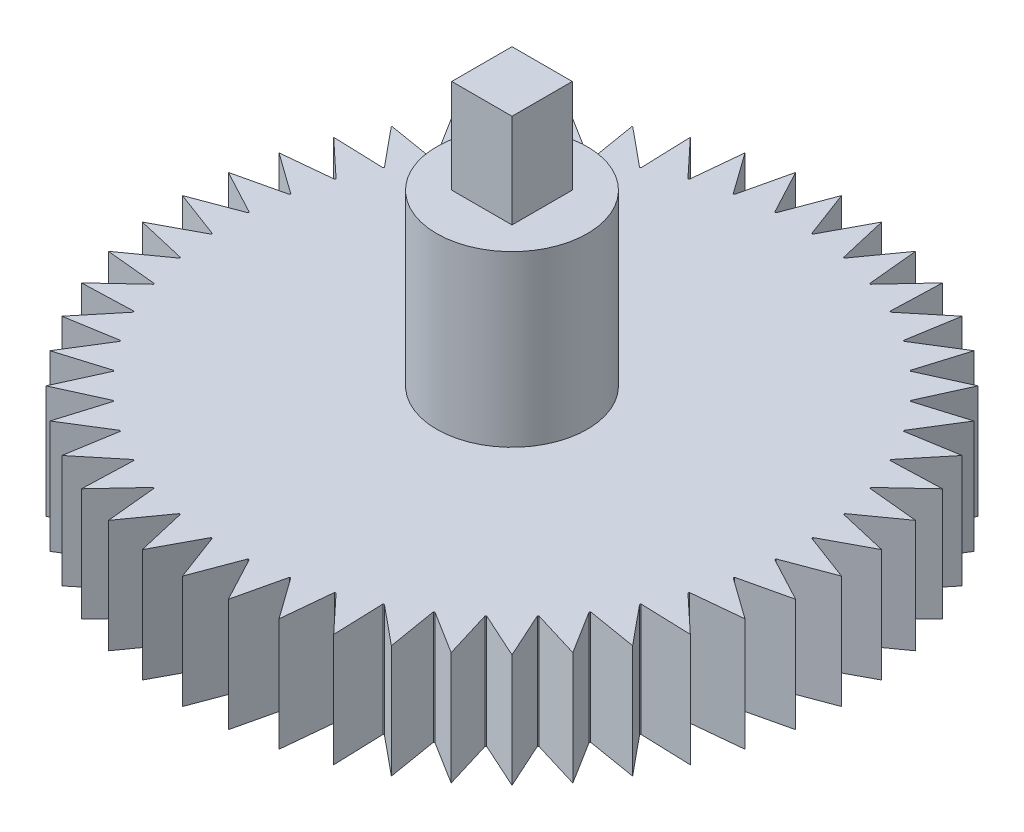
from build123d import *

# Parameters (mm, degrees)
EXTRUDE_5_DEPTH  = 6
EXTRUDE_6_DEPTH  = 6
SKETCH_6_R       = 4
EXTRUDE_9_DEPTH  = 5
EXTRUDE_START    = 9
SKETCH_4_R       = 4
EXTRUDE_10_DEPTH = 9
SKETCH_5_W       = 3.2
SKETCH_5_H       = 3.2
EXTRUDE_11_DEPTH = 5


with BuildPart() as part:
    # Эскиз1 → Бобышка-Вытянуть5 (new body)
    with BuildSketch(Plane(origin=(0, 0, 0), x_dir=(1, 0, 0), z_dir=(0, 1, 0))):
        with BuildLine():
            Line((2.895366476, 14.71790926), (2.284208364, 17.350285074))
            Line((2.284208364, 17.350285074), (1.012565965, 14.965784649))
            ThreePointArc((1.012565965, 14.965784649), (0.981046938, 14.967883849), (0.949523561, 14.969916667))
            Line((0.949523561, 14.969916667), (0, 17.5))
            Line((0, 17.5), (-0.949523561, 14.969916667))
            ThreePointArc((-0.949523561, 14.969916667), (-0.981046938, 14.967883849), (-1.012565965, 14.965784649))
            Line((-1.012565965, 14.965784649), (-2.284208364, 17.350285074))
            Line((-2.284208364, 17.350285074), (-2.895366476, 14.71790926))
            ThreePointArc((-2.895366476, 14.71790926), (-2.92635483, 14.711779206), (-2.957330207, 14.705583907))
            Line((-2.957330207, 14.705583907), (-4.529333289, 16.90370196))
            Line((-4.529333289, 16.90370196), (-4.791668867, 14.214074344))
            ThreePointArc((-4.791668867, 14.214074344), (-4.82159198, 14.203951942), (-4.851493708, 14.193766547))
            Line((-4.851493708, 14.193766547), (-6.696960066, 16.167891819))
            Line((-6.696960066, 16.167891819), (-6.605984476, 13.467032676))
            ThreePointArc((-6.605984476, 13.467032676), (-6.634330353, 13.453091123), (-6.662646808, 13.439089906))
            Line((-6.662646808, 13.439089906), (-8.75, 15.155444566))
            Line((-8.75, 15.155444566), (-8.307269859, 12.489566345))
            ThreePointArc((-8.307269859, 12.489566345), (-8.333553495, 12.472044185), (-8.359800173, 12.454466711))
            Line((-8.359800173, 12.454466711), (-10.653325008, 13.883683455))
            Line((-10.653325008, 13.883683455), (-9.866415551, 11.298400071))
            ThreePointArc((-9.866415551, 11.298400071), (-9.890187227, 11.277597112), (-9.91391504, 11.256744138))
            Line((-9.91391504, 11.256744138), (-12.374368671, 12.374368671))
            Line((-12.374368671, 12.374368671), (-11.256744138, 9.91391504))
            ThreePointArc((-11.256744138, 9.91391504), (-11.277597112, 9.890187227), (-11.298400071, 9.866415551))
            Line((-11.298400071, 9.866415551), (-13.883683455, 10.653325008))
            Line((-13.883683455, 10.653325008), (-12.454466711, 8.359800173))
            ThreePointArc((-12.454466711, 8.359800173), (-12.472044185, 8.333553495), (-12.489566345, 8.307269859))
            Line((-12.489566345, 8.307269859), (-15.155444566, 8.75))
            Line((-15.155444566, 8.75), (-13.439089906, 6.662646808))
            ThreePointArc((-13.439089906, 6.662646808), (-13.453091123, 6.634330353), (-13.467032676, 6.605984476))
            Line((-13.467032676, 6.605984476), (-16.167891819, 6.696960066))
            Line((-16.167891819, 6.696960066), (-14.193766547, 4.851493708))
            ThreePointArc((-14.193766547, 4.851493708), (-14.203951942, 4.82159198), (-14.214074344, 4.791668867))
            Line((-14.214074344, 4.791668867), (-16.90370196, 4.529333289))
            Line((-16.90370196, 4.529333289), (-14.705583907, 2.957330207))
            ThreePointArc((-14.705583907, 2.957330207), (-14.711779206, 2.92635483), (-14.71790926, 2.895366476))
            Line((-14.71790926, 2.895366476), (-17.350285074, 2.284208364))
            Line((-17.350285074, 2.284208364), (-14.965784649, 1.012565965))
            ThreePointArc((-14.965784649, 1.012565965), (-14.967883849, 0.981046938), (-14.969916667, 0.949523561))
            Line((-14.969916667, 0.949523561), (-17.5, 0))
            Line((-17.5, 0), (-14.969916667, -0.949523561))
            ThreePointArc((-14.969916667, -0.949523561), (-14.967883849, -0.981046938), (-14.965784649, -1.012565965))
            Line((-14.965784649, -1.012565965), (-17.350285074, -2.284208364))
            Line((-17.350285074, -2.284208364), (-14.71790926, -2.895366476))
            ThreePointArc((-14.71790926, -2.895366476), (-14.711779206, -2.92635483), (-14.705583907, -2.957330207))
            Line((-14.705583907, -2.957330207), (-16.90370196, -4.529333289))
            Line((-16.90370196, -4.529333289), (-14.214074344, -4.791668867))
            ThreePointArc((-14.214074344, -4.791668867), (-14.203951942, -4.82159198), (-14.193766547, -4.851493708))
            Line((-14.193766547, -4.851493708), (-16.167891819, -6.696960066))
            Line((-16.167891819, -6.696960066), (-13.467032676, -6.605984476))
            ThreePointArc((-13.467032676, -6.605984476), (-13.453091123, -6.634330353), (-13.439089906, -6.662646808))
            Line((-13.439089906, -6.662646808), (-15.155444566, -8.75))
            Line((-15.155444566, -8.75), (-12.489566345, -8.307269859))
            ThreePointArc((-12.489566345, -8.307269859), (-12.472044185, -8.333553495), (-12.454466711, -8.359800173))
            Line((-12.454466711, -8.359800173), (-13.883683455, -10.653325008))
            Line((-13.883683455, -10.653325008), (-11.298400071, -9.866415551))
            ThreePointArc((-11.298400071, -9.866415551), (-11.277597112, -9.890187227), (-11.256744138, -9.91391504))
            Line((-11.256744138, -9.91391504), (-12.374368671, -12.374368671))
            Line((-12.374368671, -12.374368671), (-9.91391504, -11.256744138))
            ThreePointArc((-9.91391504, -11.256744138), (-9.890187227, -11.277597112), (-9.866415551, -11.298400071))
            Line((-9.866415551, -11.298400071), (-10.653325008, -13.883683455))
            Line((-10.653325008, -13.883683455), (-8.359800173, -12.454466711))
            ThreePointArc((-8.359800173, -12.454466711), (-8.333553495, -12.472044185), (-8.307269859, -12.489566345))
            Line((-8.307269859, -12.489566345), (-8.75, -15.155444566))
            Line((-8.75, -15.155444566), (-6.662646808, -13.439089906))
            ThreePointArc((-6.662646808, -13.439089906), (-6.634330353, -13.453091123), (-6.605984476, -13.467032676))
            Line((-6.605984476, -13.467032676), (-6.696960066, -16.167891819))
            Line((-6.696960066, -16.167891819), (-4.851493708, -14.193766547))
            ThreePointArc((-4.851493708, -14.193766547), (-4.82159198, -14.203951942), (-4.791668867, -14.214074344))
            Line((-4.791668867, -14.214074344), (-4.529333289, -16.90370196))
            Line((-4.529333289, -16.90370196), (-2.957330207, -14.705583907))
            ThreePointArc((-2.957330207, -14.705583907), (-2.92635483, -14.711779206), (-2.895366476, -14.71790926))
            Line((-2.895366476, -14.71790926), (-2.284208364, -17.350285074))
            Line((-2.284208364, -17.350285074), (-1.012565965, -14.965784649))
            ThreePointArc((-1.012565965, -14.965784649), (-0.981046938, -14.967883849), (-0.949523561, -14.969916667))
            Line((-0.949523561, -14.969916667), (0, -17.5))
            Line((0, -17.5), (0.949523561, -14.969916667))
            ThreePointArc((0.949523561, -14.969916667), (0.981046938, -14.967883849), (1.012565965, -14.965784649))
            Line((1.012565965, -14.965784649), (2.284208364, -17.350285074))
            Line((2.284208364, -17.350285074), (2.895366476, -14.71790926))
            ThreePointArc((2.895366476, -14.71790926), (2.92635483, -14.711779206), (2.957330207, -14.705583907))
            Line((2.957330207, -14.705583907), (4.529333289, -16.90370196))
            Line((4.529333289, -16.90370196), (4.791668867, -14.214074344))
            ThreePointArc((4.791668867, -14.214074344), (4.82159198, -14.203951942), (4.851493708, -14.193766547))
            Line((4.851493708, -14.193766547), (6.696960066, -16.167891819))
            Line((6.696960066, -16.167891819), (6.605984476, -13.467032676))
            ThreePointArc((6.605984476, -13.467032676), (6.634330353, -13.453091123), (6.662646808, -13.439089906))
            Line((6.662646808, -13.439089906), (8.75, -15.155444566))
            Line((8.75, -15.155444566), (8.307269859, -12.489566345))
            ThreePointArc((8.307269859, -12.489566345), (8.333553495, -12.472044185), (8.359800173, -12.454466711))
            Line((8.359800173, -12.454466711), (10.653325008, -13.883683455))
            Line((10.653325008, -13.883683455), (9.866415551, -11.298400071))
            ThreePointArc((9.866415551, -11.298400071), (9.890187227, -11.277597112), (9.91391504, -11.256744138))
            Line((9.91391504, -11.256744138), (12.374368671, -12.374368671))
            Line((12.374368671, -12.374368671), (11.256744138, -9.91391504))
            ThreePointArc((11.256744138, -9.91391504), (11.277597112, -9.890187227), (11.298400071, -9.866415551))
            Line((11.298400071, -9.866415551), (13.883683455, -10.653325008))
            Line((13.883683455, -10.653325008), (12.454466711, -8.359800173))
            ThreePointArc((12.454466711, -8.359800173), (12.472044185, -8.333553495), (12.489566345, -8.307269859))
            Line((12.489566345, -8.307269859), (15.155444566, -8.75))
            Line((15.155444566, -8.75), (13.439089906, -6.662646808))
            ThreePointArc((13.439089906, -6.662646808), (13.453091123, -6.634330353), (13.467032676, -6.605984476))
            Line((13.467032676, -6.605984476), (16.167891819, -6.696960066))
            Line((16.167891819, -6.696960066), (14.193766547, -4.851493708))
            ThreePointArc((14.193766547, -4.851493708), (14.203951942, -4.82159198), (14.214074344, -4.791668867))
            Line((14.214074344, -4.791668867), (16.90370196, -4.529333289))
            Line((16.90370196, -4.529333289), (14.705583907, -2.957330207))
            ThreePointArc((14.705583907, -2.957330207), (14.711779206, -2.92635483), (14.71790926, -2.895366476))
            Line((14.71790926, -2.895366476), (17.350285074, -2.284208364))
            Line((17.350285074, -2.284208364), (14.965784649, -1.012565965))
            ThreePointArc((14.965784649, -1.012565965), (14.967883849, -0.981046938), (14.969916667, -0.949523561))
            Line((14.969916667, -0.949523561), (17.5, 0))
            Line((17.5, 0), (14.969916667, 0.949523561))
            ThreePointArc((14.969916667, 0.949523561), (14.967883849, 0.981046938), (14.965784649, 1.012565965))
            Line((14.965784649, 1.012565965), (17.350285074, 2.284208364))
            Line((17.350285074, 2.284208364), (14.71790926, 2.895366476))
            ThreePointArc((14.71790926, 2.895366476), (14.711779206, 2.92635483), (14.705583907, 2.957330207))
            Line((14.705583907, 2.957330207), (16.90370196, 4.529333289))
            Line((16.90370196, 4.529333289), (14.214074344, 4.791668867))
            ThreePointArc((14.214074344, 4.791668867), (14.203951942, 4.82159198), (14.193766547, 4.851493708))
            Line((14.193766547, 4.851493708), (16.167891819, 6.696960066))
            Line((16.167891819, 6.696960066), (13.467032676, 6.605984476))
            ThreePointArc((13.467032676, 6.605984476), (13.453091123, 6.634330353), (13.439089906, 6.662646808))
            Line((13.439089906, 6.662646808), (15.155444566, 8.75))
            Line((15.155444566, 8.75), (12.489566345, 8.307269859))
            ThreePointArc((12.489566345, 8.307269859), (12.472044185, 8.333553495), (12.454466711, 8.359800173))
            Line((12.454466711, 8.359800173), (13.883683455, 10.653325008))
            Line((13.883683455, 10.653325008), (11.298400071, 9.866415551))
            ThreePointArc((11.298400071, 9.866415551), (11.277597112, 9.890187227), (11.256744138, 9.91391504))
            Line((11.256744138, 9.91391504), (12.374368671, 12.374368671))
            Line((12.374368671, 12.374368671), (9.91391504, 11.256744138))
            ThreePointArc((9.91391504, 11.256744138), (9.890187227, 11.277597112), (9.866415551, 11.298400071))
            Line((9.866415551, 11.298400071), (10.653325008, 13.883683455))
            Line((10.653325008, 13.883683455), (8.359800173, 12.454466711))
            ThreePointArc((8.359800173, 12.454466711), (8.333553495, 12.472044185), (8.307269859, 12.489566345))
            Line((8.307269859, 12.489566345), (8.75, 15.155444566))
            Line((8.75, 15.155444566), (6.662646808, 13.439089906))
            ThreePointArc((6.662646808, 13.439089906), (6.634330353, 13.453091123), (6.605984476, 13.467032676))
            Line((6.605984476, 13.467032676), (6.696960066, 16.167891819))
            Line((6.696960066, 16.167891819), (4.851493708, 14.193766547))
            ThreePointArc((4.851493708, 14.193766547), (4.82159198, 14.203951942), (4.791668867, 14.214074344))
            Line((4.791668867, 14.214074344), (4.529333289, 16.90370196))
            Line((4.529333289, 16.90370196), (2.957330207, 14.705583907))
            ThreePointArc((2.957330207, 14.705583907), (2.92635483, 14.711779206), (2.895366476, 14.71790926))
        make_face()
        with BuildLine():
            ThreePointArc((2.2, 1.5), (2.517970617, 0), (2.2, -1.5))
            Line((2.2, -1.5), (-2.2, -1.5))
            ThreePointArc((-2.2, -1.5), (-2.493941045, 0), (-2.2, 1.5))
            Line((-2.2, 1.5), (2.2, 1.5))
        make_face(mode=Mode.SUBTRACT)
    extrude(amount=EXTRUDE_5_DEPTH)

    # Эскиз1<5> → Бобышка-Вытянуть6 (add)
    with BuildSketch(Plane(origin=(0, 0, 0), x_dir=(1, 0, 0), z_dir=(0, 1, 0))):
        with BuildLine():
            Line((0, 1.5), (2.2, 1.5))
            ThreePointArc((2.2, 1.5), (2.517970617, 0), (2.2, -1.5))
            Line((2.2, -1.5), (0, -1.5))
            Line((0, -1.5), (-2.2, -1.5))
            ThreePointArc((-2.2, -1.5), (-2.493941045, 0), (-2.2, 1.5))
            Line((-2.2, 1.5), (0, 1.5))
        make_face()
    extrude(amount=EXTRUDE_6_DEPTH)

    # Эскиз6 → Бобышка-Вытянуть9 (add)
    with BuildSketch(Plane(origin=(0, 0, 0), x_dir=(-1, 0, 0), z_dir=(0, -1, 0))):
        Circle(SKETCH_6_R)
    extrude(amount=EXTRUDE_9_DEPTH)

    # Эскиз4 → Бобышка-Вытянуть10 (add)
    with BuildSketch(Plane(origin=(0, 6, 0), x_dir=(1, 0, 0), z_dir=(0, 1, 0)).offset(EXTRUDE_START)):
        Circle(SKETCH_4_R)
    extrude(amount=-EXTRUDE_10_DEPTH)

    # Эскиз5 → Бобышка-Вытянуть11 (add)
    with BuildSketch(Plane(origin=(0, 15, 0), x_dir=(-1, 0, 0), z_dir=(0, -1, 0))):
        Rectangle(SKETCH_5_W, SKETCH_5_H)
    extrude(amount=-EXTRUDE_11_DEPTH)


solid = part.part
